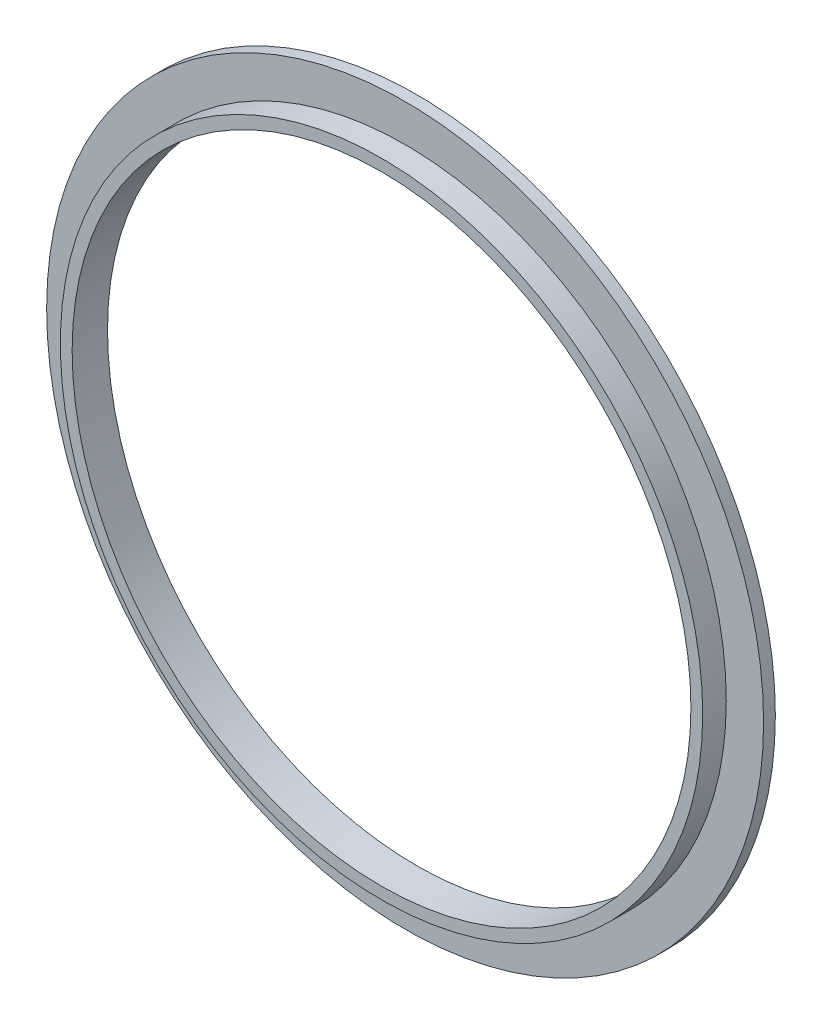
from build123d import *
from build123d.topology import SkipClean

# Parameters (mm, degrees)
SKETCH1_R           = 54.5
SKETCH1_R_2         = 52.5
BOSS_EXTRUDE1_DEPTH = 4
BOSS_EXTRUDE2_START = 2
SKETCH2_R           = 60.83
SKETCH2_R_2         = 52.5
BOSS_EXTRUDE2_DEPTH = 2


with BuildPart() as part:
    # Sketch1 → Boss-Extrude1 (new body)
    with BuildSketch(Plane.XY):
        Circle(SKETCH1_R)
        Circle(SKETCH1_R_2, mode=Mode.SUBTRACT)
    extrude(amount=BOSS_EXTRUDE1_DEPTH)

    # Sketch2 → Boss-Extrude2 (add)
    with SkipClean():  # the faces are left unmerged after this step: merging them gives an invalid solid
        with BuildSketch(Plane(origin=(0, 0, 0), x_dir=(-1, 0, 0), z_dir=(0, 0, -1)).offset(BOSS_EXTRUDE2_START)):
            Circle(SKETCH2_R)
            Circle(SKETCH2_R_2, mode=Mode.SUBTRACT)
        extrude(amount=-BOSS_EXTRUDE2_DEPTH)


solid = part.part
